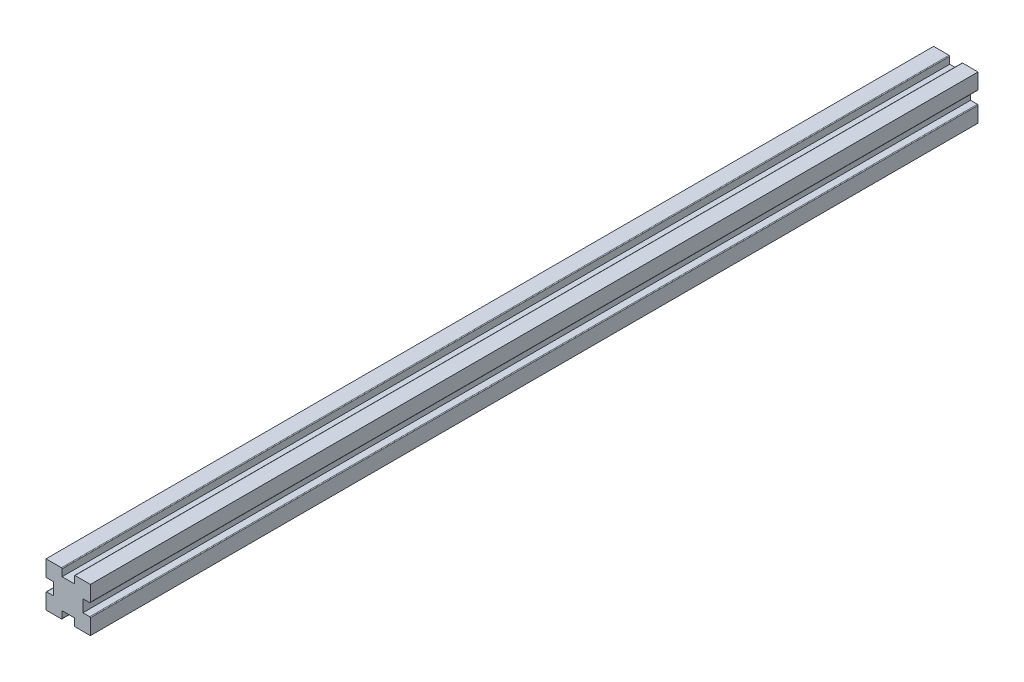
from build123d import *

# Parameters (mm, degrees)
BOSS_EXTRUDE1_DEPTH = 609.6
FILLET1_R           = 0.5


with BuildPart() as part:
    # Sketch1 → Boss-Extrude1 (new body)
    with BuildSketch(Plane.XY):
        Polygon((10.108163265, 4.185), (15.24, 4.185), (15.24, 15.24), (4.185, 15.24), (4.185, 10.108163265), (-4.185, 10.108163265), (-4.185, 15.24), (-15.24, 15.24), (-15.24, 4.185), (-10.108163265, 4.185), (-10.108163265, -4.185), (-15.24, -4.185), (-15.24, -15.24), (-4.185, -15.24), (-4.185, -10.108163265), (4.185, -10.108163265), (4.185, -15.24), (15.24, -15.24), (15.24, -4.185), (10.108163265, -4.185), align=None)
    extrude(amount=BOSS_EXTRUDE1_DEPTH)

    # Fillet1
    fillet1_edges = [part.edges().sort_by_distance(p)[0] for p in [
        (-15.24, 4.185, 304.8),
        (-4.185, 15.24, 304.8),
        (4.185, 15.24, 304.8),
        (15.24, 4.185, 304.8),
        (15.24, -4.185, 304.8),
        (4.185, -15.24, 304.8),
        (-4.185, -15.24, 304.8),
        (-15.24, -4.185, 304.8),
    ]]
    fillet(fillet1_edges, radius=FILLET1_R)


solid = part.part
